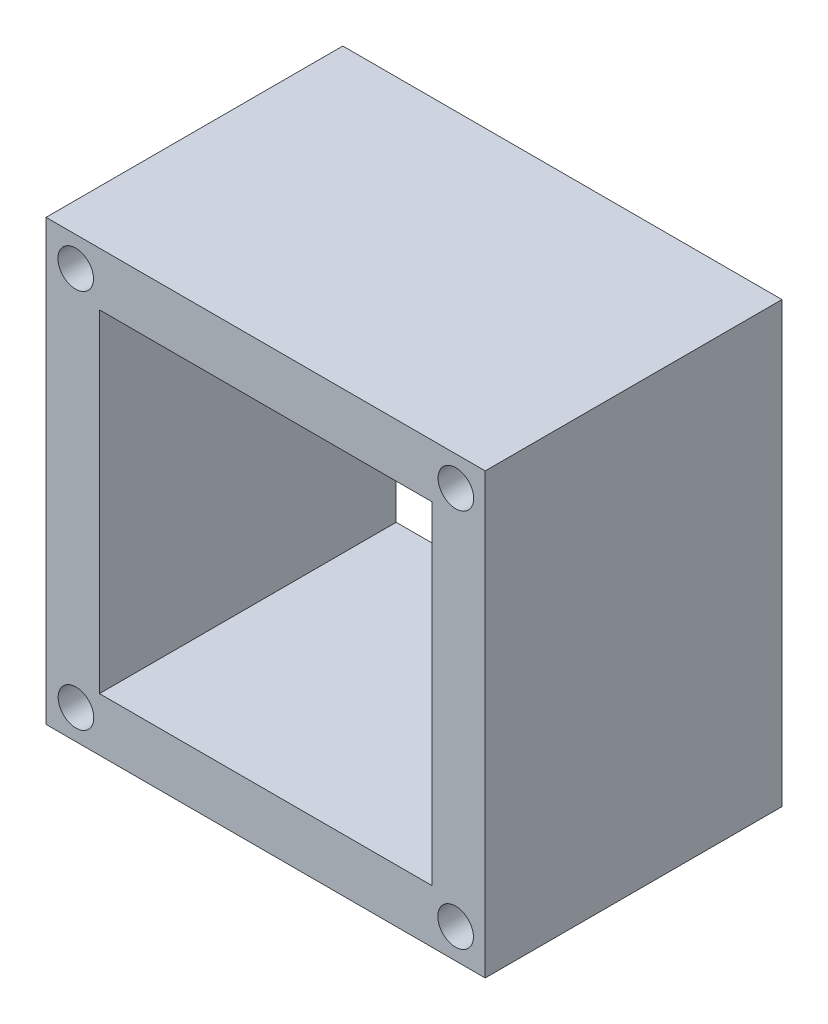
from build123d import *

# Parameters (mm, degrees)
SKETCH1_W           = 37
SKETCH1_H           = 37
BOSS_EXTRUDE1_DEPTH = 25
SKETCH2_W           = 28
SKETCH2_H           = 28
CUT_EXTRUDE1_DEPTH  = 37.187014245
SKETCH6_R           = 1.5
CUT_EXTRUDE3_DEPTH  = 37.187014245


with BuildPart() as part:
    # Sketch1 → Boss-Extrude1 (new body)
    with BuildSketch(Plane.XY):
        Rectangle(SKETCH1_W, SKETCH1_H)
    extrude(amount=BOSS_EXTRUDE1_DEPTH)

    # Sketch2 → Cut-Extrude1 (cut, through all)
    with BuildSketch(Plane.XY.offset(25)):
        Rectangle(SKETCH2_W, SKETCH2_H)
    extrude(amount=-CUT_EXTRUDE1_DEPTH, mode=Mode.SUBTRACT)

    # Sketch6 → Cut-Extrude3 (cut, through all)
    with BuildSketch(Plane.XY.offset(25)):
        with Locations((-16.003913062, 16.003913062)):
            Circle(SKETCH6_R)
        with Locations((16.027281765, 15.994713508)):
            Circle(SKETCH6_R)
        with Locations((16.003485412, -15.997947579)):
            Circle(SKETCH6_R)
        with Locations((-15.978784004, -16.00393382)):
            Circle(SKETCH6_R)
    extrude(amount=-CUT_EXTRUDE3_DEPTH, mode=Mode.SUBTRACT)


solid = part.part
